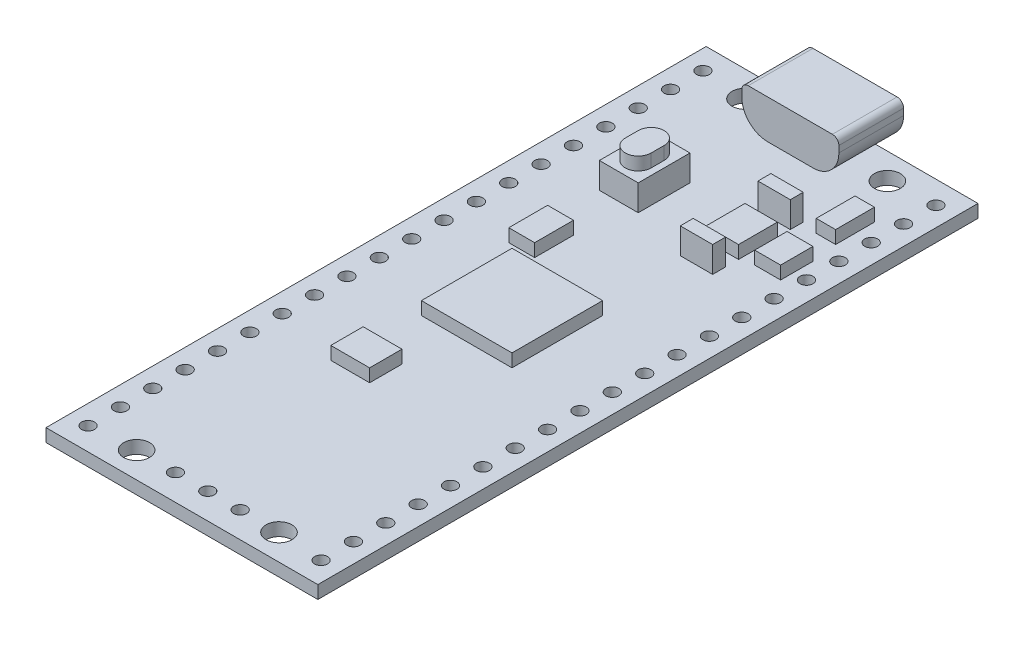
from build123d import *

# Parameters (mm, degrees)
SKETCH1_W           = 21
SKETCH1_H           = 51
TOPFACE_DEPTH       = 1
SKETCH2_R           = 0.5
SKETCH2_R_2         = 1
CUT_EXTRUDE1_DEPTH  = 28.595289453
SKETCH3_W           = 7
SKETCH3_H           = 7
BOSS_EXTRUDE2_DEPTH = 1
SKETCH4_W           = 3
SKETCH4_H           = 4
BOSS_EXTRUDE3_DEPTH = 2
BOSS_EXTRUDE4_DEPTH = 1
SKETCH6_W           = 1.5
SKETCH6_H           = 3
SKETCH6_W_2         = 2
SKETCH6_H_2         = 2.5
SKETCH6_W_3         = 2.5
SKETCH6_W_4         = 3
BOSS_EXTRUDE5_DEPTH = 1
SKETCH7_W           = 2.5
SKETCH7_H           = 1
BOSS_EXTRUDE6_DEPTH = 2
BOSS_EXTRUDE7_DEPTH = 4
BOSS_EXTRUDE8_START = 1
BOSS_EXTRUDE8_DEPTH = 1
CUT_EXTRUDE2_DEPTH  = 4.8
SKETCH11_W          = 3
SKETCH11_H          = 0.2
BOSS_EXTRUDE9_DEPTH = 3


with BuildPart() as part:
    # Sketch1 → TopFace (new body)
    with BuildSketch(Plane(origin=(0, 0, 0), x_dir=(1, 0, 0), z_dir=(0, 1, 0))):
        Rectangle(SKETCH1_W, SKETCH1_H)
    extrude(amount=TOPFACE_DEPTH)

    # Sketch2 → Cut-Extrude1 (cut, through all)
    with BuildSketch(Plane(origin=(0, 1, 0), x_dir=(1, 0, 0), z_dir=(0, 1, 0))):
        with Locations(Location((-9, 23.75, 0), (0, 0, 270))):
            Circle(SKETCH2_R)
        with Locations(Location((-9, 21.25, 0), (0, 0, 270))):
            Circle(SKETCH2_R)
        with Locations(Location((-9, 18.75, 0), (0, 0, 270))):
            Circle(SKETCH2_R)
        with Locations(Location((-9, 16.25, 0), (0, 0, 270))):
            Circle(SKETCH2_R)
        with Locations(Location((-9, 13.75, 0), (0, 0, 270))):
            Circle(SKETCH2_R)
        with Locations(Location((-9, 11.25, 0), (0, 0, 270))):
            Circle(SKETCH2_R)
        with Locations(Location((-9, 8.75, 0), (0, 0, 270))):
            Circle(SKETCH2_R)
        with Locations(Location((-9, 6.25, 0), (0, 0, 270))):
            Circle(SKETCH2_R)
        with Locations(Location((-9, 3.75, 0), (0, 0, 270))):
            Circle(SKETCH2_R)
        with Locations(Location((-9, 1.25, 0), (0, 0, 270))):
            Circle(SKETCH2_R)
        with Locations(Location((-9, -1.25, 0), (0, 0, 270))):
            Circle(SKETCH2_R)
        with Locations(Location((-9, -3.75, 0), (0, 0, 270))):
            Circle(SKETCH2_R)
        with Locations(Location((-9, -6.25, 0), (0, 0, 270))):
            Circle(SKETCH2_R)
        with Locations(Location((-9, -8.75, 0), (0, 0, 270))):
            Circle(SKETCH2_R)
        with Locations(Location((-9, -11.25, 0), (0, 0, 270))):
            Circle(SKETCH2_R)
        with Locations(Location((-9, -13.75, 0), (0, 0, 270))):
            Circle(SKETCH2_R)
        with Locations(Location((-9, -16.25, 0), (0, 0, 270))):
            Circle(SKETCH2_R)
        with Locations(Location((-9, -18.75, 0), (0, 0, 270))):
            Circle(SKETCH2_R)
        with Locations(Location((-9, -21.25, 0), (0, 0, 270))):
            Circle(SKETCH2_R)
        with Locations(Location((-9, -23.75, 0), (0, 0, 270))):
            Circle(SKETCH2_R)
        with Locations(Location((9, -23.75, 0), (0, 0, 90))):
            Circle(SKETCH2_R)
        with Locations(Location((9, -21.25, 0), (0, 0, 90))):
            Circle(SKETCH2_R)
        with Locations(Location((9, -18.75, 0), (0, 0, 90))):
            Circle(SKETCH2_R)
        with Locations(Location((9, -16.25, 0), (0, 0, 90))):
            Circle(SKETCH2_R)
        with Locations(Location((9, -13.75, 0), (0, 0, 90))):
            Circle(SKETCH2_R)
        with Locations(Location((9, -11.25, 0), (0, 0, 90))):
            Circle(SKETCH2_R)
        with Locations(Location((9, -8.75, 0), (0, 0, 90))):
            Circle(SKETCH2_R)
        with Locations(Location((9, -6.25, 0), (0, 0, 90))):
            Circle(SKETCH2_R)
        with Locations(Location((9, -3.75, 0), (0, 0, 90))):
            Circle(SKETCH2_R)
        with Locations(Location((9, -1.25, 0), (0, 0, 90))):
            Circle(SKETCH2_R)
        with Locations(Location((9, 1.25, 0), (0, 0, 90))):
            Circle(SKETCH2_R)
        with Locations(Location((9, 3.75, 0), (0, 0, 90))):
            Circle(SKETCH2_R)
        with Locations(Location((9, 6.25, 0), (0, 0, 90))):
            Circle(SKETCH2_R)
        with Locations(Location((9, 8.75, 0), (0, 0, 90))):
            Circle(SKETCH2_R)
        with Locations(Location((9, 11.25, 0), (0, 0, 90))):
            Circle(SKETCH2_R)
        with Locations(Location((9, 13.75, 0), (0, 0, 90))):
            Circle(SKETCH2_R)
        with Locations(Location((9, 16.25, 0), (0, 0, 90))):
            Circle(SKETCH2_R)
        with Locations(Location((9, 18.75, 0), (0, 0, 90))):
            Circle(SKETCH2_R)
        with Locations(Location((9, 21.25, 0), (0, 0, 90))):
            Circle(SKETCH2_R)
        with Locations(Location((9, 23.75, 0), (0, 0, 90))):
            Circle(SKETCH2_R)
        with Locations(Location((0, -23.5, 0), (0, 0, 270))):
            Circle(SKETCH2_R)
        with Locations(Location((-2.5, -23.5, 0), (0, 0, 270))):
            Circle(SKETCH2_R)
        with Locations(Location((2.5, -23.5, 0), (0, 0, 90))):
            Circle(SKETCH2_R)
        with Locations(Location((-5.5, -23.5, 0), (0, 0, 270))):
            Circle(SKETCH2_R_2)
        with Locations(Location((5.5, -23.5, 0), (0, 0, 90))):
            Circle(SKETCH2_R_2)
        with Locations(Location((-5.5, 23.5, 0), (0, 0, 90))):
            Circle(SKETCH2_R_2)
        with Locations(Location((5.5, 23.5, 0), (0, 0, 270))):
            Circle(SKETCH2_R_2)
    extrude(amount=-CUT_EXTRUDE1_DEPTH, mode=Mode.SUBTRACT)

    # Sketch3 → Boss-Extrude2 (add)
    with BuildSketch(Plane(origin=(0, 1, 0), x_dir=(1, 0, 0), z_dir=(0, 1, 0))):
        Rectangle(SKETCH3_W, SKETCH3_H)
    extrude(amount=BOSS_EXTRUDE2_DEPTH)

    # Sketch4 → Boss-Extrude3 (add)
    with BuildSketch(Plane(origin=(0, 1, 0), x_dir=(1, 0, 0), z_dir=(0, 1, 0))):
        with Locations((-3.5, 13.75)):
            Rectangle(SKETCH4_W, SKETCH4_H)
    extrude(amount=BOSS_EXTRUDE3_DEPTH)

    # Sketch5 → Boss-Extrude4 (add)
    with BuildSketch(Plane(origin=(0, 3, 0), x_dir=(1, 0, 0), z_dir=(0, 1, 0))):
        with BuildLine():
            Line((-2.5, 14.25), (-2.5, 13.25))
            ThreePointArc((-2.5, 13.25), (-3.5, 12.25), (-4.5, 13.25))
            Line((-4.5, 13.25), (-4.5, 14.25))
            ThreePointArc((-4.5, 14.25), (-3.5, 15.25), (-2.5, 14.25))
        make_face()
    extrude(amount=BOSS_EXTRUDE4_DEPTH)

    # Sketch6 → Boss-Extrude5 (add)
    with BuildSketch(Plane(origin=(0, 1, 0), x_dir=(1, 0, 0), z_dir=(0, 1, 0))):
        with Locations((7, 18.75)):
            Rectangle(SKETCH6_W, SKETCH6_H)
        with Locations((7, 14)):
            Rectangle(SKETCH6_W_2, SKETCH6_H_2)
        with Locations((3.75, 14)):
            Rectangle(SKETCH6_W_3, SKETCH6_H)
        with Locations((-4, 6.25)):
            Rectangle(SKETCH6_W_2, SKETCH6_H)
        with Locations((-2.5, -8.75)):
            Rectangle(SKETCH6_W_4, SKETCH6_H_2)
    extrude(amount=BOSS_EXTRUDE5_DEPTH)

    # Sketch7 → Boss-Extrude6 (add)
    with BuildSketch(Plane(origin=(0, 1, 0), x_dir=(1, 0, 0), z_dir=(0, 1, 0))):
        with Locations((3.75, 17)):
            Rectangle(SKETCH7_W, SKETCH7_H)
        with Locations((3.75, 11)):
            Rectangle(SKETCH7_W, SKETCH7_H)
    extrude(amount=BOSS_EXTRUDE6_DEPTH)

    # Sketch8 → Boss-Extrude7 (add)
    with BuildSketch(Plane(origin=(0, 0, -25.5), x_dir=(-1, 0, 0), z_dir=(0, 0, -1))):
        with BuildLine():
            Line((-3.25, 4), (3.25, 4))
            ThreePointArc((3.25, 4), (3.603553391, 3.853553391), (3.75, 3.5))
            Line((3.75, 3.5), (3.75, 3))
            ThreePointArc((3.75, 3), (3.164213562, 1.585786438), (1.75, 1))
            Line((1.75, 1), (-1.75, 1))
            ThreePointArc((-1.75, 1), (-3.164213562, 1.585786438), (-3.75, 3))
            Line((-3.75, 3), (-3.75, 3.5))
            ThreePointArc((-3.75, 3.5), (-3.603553391, 3.853553391), (-3.25, 4))
        make_face()
    extrude(amount=-BOSS_EXTRUDE7_DEPTH)

    # Sketch9 → Boss-Extrude8 (add)
    with BuildSketch(Plane(origin=(0, 0, -25.5), x_dir=(-1, 0, 0), z_dir=(0, 0, -1)).offset(BOSS_EXTRUDE8_START)):
        with BuildLine():
            Line((-1.75, 1), (1.75, 1))
            ThreePointArc((1.75, 1), (3.164213562, 1.585786438), (3.75, 3))
            Line((3.75, 3), (3.75, 3.5))
            ThreePointArc((3.75, 3.5), (3.603553391, 3.853553391), (3.25, 4))
            Line((3.25, 4), (-3.25, 4))
            ThreePointArc((-3.25, 4), (-3.603553391, 3.853553391), (-3.75, 3.5))
            Line((-3.75, 3.5), (-3.75, 3))
            ThreePointArc((-3.75, 3), (-3.164213562, 1.585786438), (-1.75, 1))
        make_face()
    extrude(amount=-BOSS_EXTRUDE8_DEPTH)

    # Sketch10 → Cut-Extrude2 (cut)
    with BuildSketch(Plane(origin=(0, 0, -26.5), x_dir=(-1, 0, 0), z_dir=(0, 0, -1))):
        with BuildLine():
            Line((3.25, 3.9), (-3.25, 3.9))
            ThreePointArc((-3.25, 3.9), (-3.532842712, 3.782842712), (-3.65, 3.5))
            Line((-3.65, 3.5), (-3.65, 3))
            ThreePointArc((-3.65, 3), (-3.093502884, 1.656497116), (-1.75, 1.1))
            Line((-1.75, 1.1), (1.75, 1.1))
            ThreePointArc((1.75, 1.1), (3.093502884, 1.656497116), (3.65, 3))
            Line((3.65, 3), (3.65, 3.5))
            ThreePointArc((3.65, 3.5), (3.532842712, 3.782842712), (3.25, 3.9))
        make_face()
    extrude(amount=-CUT_EXTRUDE2_DEPTH, mode=Mode.SUBTRACT)

    # Sketch11 → Boss-Extrude9 (add)
    with BuildSketch(Plane(origin=(0, 0, -21.7), x_dir=(-1, 0, 0), z_dir=(0, 0, -1))):
        with Locations((0, 3.15)):
            Rectangle(SKETCH11_W, SKETCH11_H)
    extrude(amount=BOSS_EXTRUDE9_DEPTH)


solid = part.part
